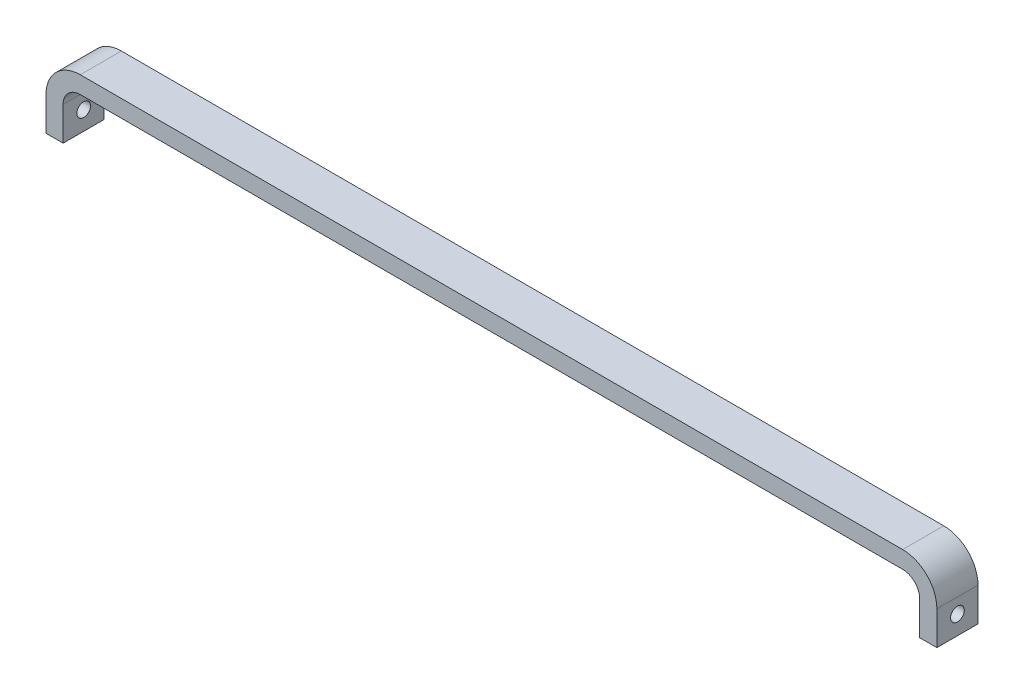
from build123d import *

# Parameters (mm, degrees)
BOSS_EXTRUDE2_DEPTH = 24
SKETCH2_R           = 4
CUT_EXTRUDE1_DEPTH  = 523.057621341


with BuildPart() as part:
    # Sketch1 → Boss-Extrude2 (new body)
    with BuildSketch(Plane.XY):
        with BuildLine():
            Line((20, 29.6), (500, 29.6))
            ThreePointArc((500, 29.6), (507.071067812, 26.671067812), (510, 19.6))
            Line((510, 19.6), (510, 0))
            Line((510, 0), (520, 0))
            Line((520, 0), (520, 19.6))
            ThreePointArc((520, 19.6), (514.142135624, 33.742135624), (500, 39.6))
            Line((500, 39.6), (20, 39.6))
            ThreePointArc((20, 39.6), (5.857864376, 33.742135624), (0, 19.6))
            Line((0, 19.6), (0, 0))
            Line((0, 0), (10, 0))
            Line((10, 0), (10, 19.6))
            ThreePointArc((10, 19.6), (12.928932188, 26.671067812), (20, 29.6))
        make_face()
    extrude(amount=BOSS_EXTRUDE2_DEPTH)

    # Sketch2 → Cut-Extrude1 (cut, through all)
    with BuildSketch(Plane.ZY):
        with Locations((12, 11)):
            Circle(SKETCH2_R)
    extrude(amount=-CUT_EXTRUDE1_DEPTH, mode=Mode.SUBTRACT)


solid = part.part
